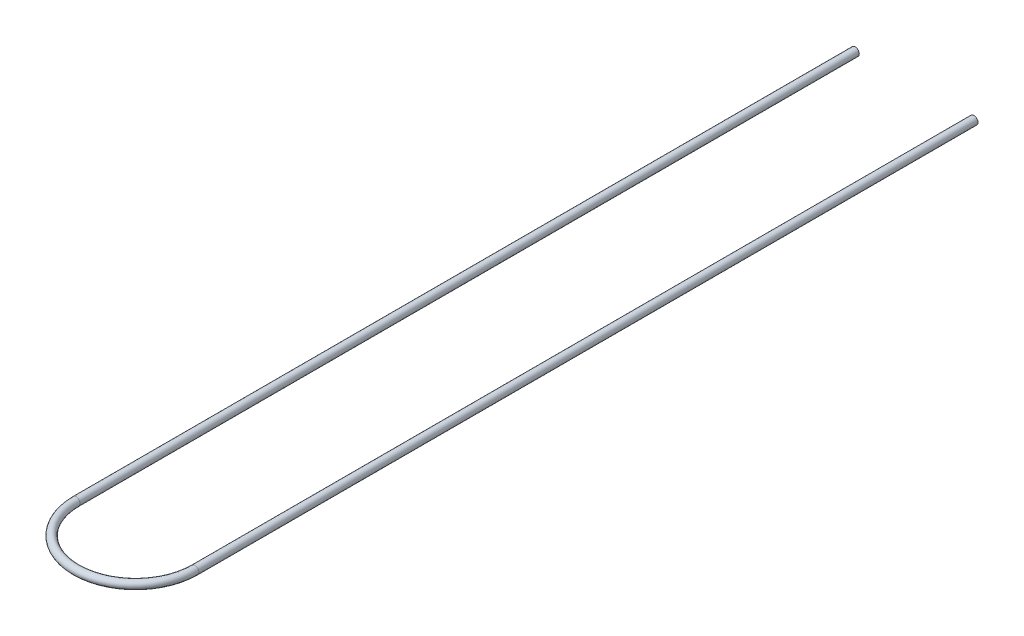
from build123d import *

# Parameters (mm, degrees)
SKETCH2_R   = 11.1
SKETCH2_R_2 = 9.95


with BuildPart() as part:
    # Sweep1: sweep along a path in Sketch1
    with BuildLine(Plane(origin=(0, 0, 0), x_dir=(1, 0, 0), z_dir=(0, 1, 0))) as sweep1_path:
        Line((286.16, -300), (286.16, -2440))
        ThreePointArc((286.16, -2440), (123.08, -2603.08), (-40, -2440))
        Line((-40, -2440), (-40, -300))
    # Sketch2 → Sweep1 (sweep)
    with BuildSketch(Plane(origin=(286.16, 0, 300), x_dir=(-1, 0, 0), z_dir=(0, 0, -1))):
        Circle(SKETCH2_R)
        Circle(SKETCH2_R_2, mode=Mode.SUBTRACT)
    sweep(path=sweep1_path.line)


solid = part.part
